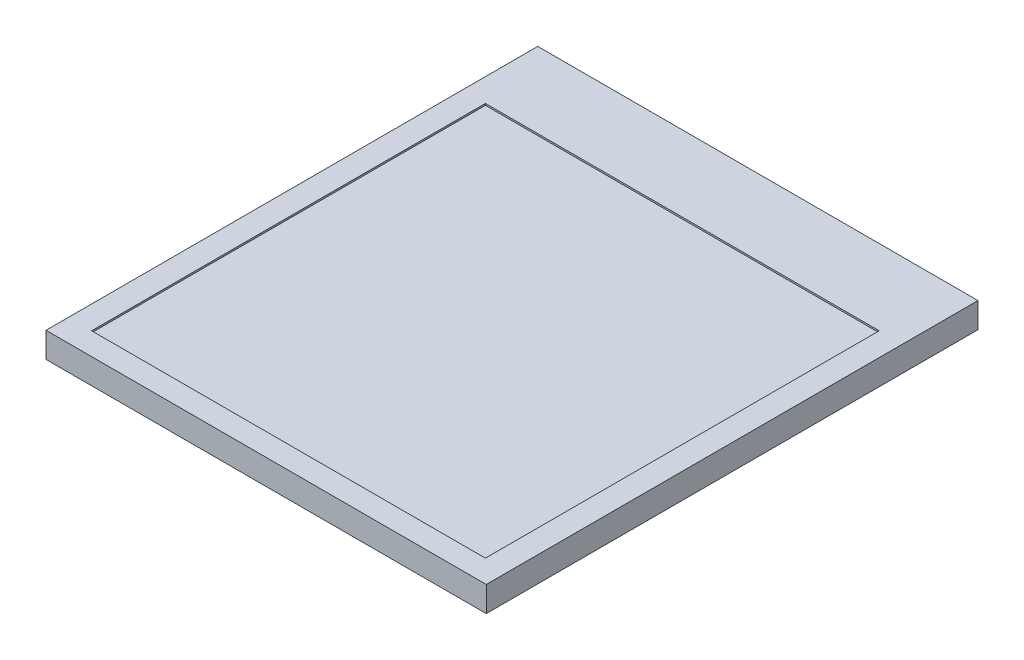
from build123d import *

# Parameters (mm, degrees)
SKETCH_1_W          = 26.16
SKETCH_1_H          = 29.22
EXTRUDE_1_DEPTH     = 1.5
EXTRUDE_2_DEPTH     = 15.86
SKETCH_4_W          = 4.46
SKETCH_4_H          = 3
CUT_EXTRUDE_1_DEPTH = 1
FILLET_2_R          = 1
SKETCH_5_W          = 23.4
SKETCH_5_H          = 23.4
CUT_EXTRUDE_2_DEPTH = 0.1
SKETCH_6_W          = 0.35
SKETCH_6_H          = 3
CUT_EXTRUDE_3_DEPTH = 0.005


with BuildPart() as part:
    # 草图1 → 凸台-拉伸1 (new body)
    with BuildSketch(Plane(origin=(0, 0, 0), x_dir=(1, 0, 0), z_dir=(0, 1, 0))):
        Rectangle(SKETCH_1_W, SKETCH_1_H)
    extrude(amount=EXTRUDE_1_DEPTH)

    # 草图3 → 凸台-拉伸2 (add)
    with BuildSketch(Plane.ZY.offset(13.08)):
        with BuildLine():
            Line((-14.61, 0), (-14.864156079, 0))
            ThreePointArc((-14.864156079, 0), (-15.664156079, -0.8), (-14.864156079, -1.6))
            Line((-14.864156079, -1.6), (-3.11, -1.6))
            Line((-3.11, -1.6), (-3.11, -1.8))
            Line((-3.11, -1.8), (-14.864156079, -1.8))
            ThreePointArc((-14.864156079, -1.8), (-15.864156079, -0.8), (-14.864156079, 0.2))
            Line((-14.864156079, 0.2), (-14.61, 0.2))
            Line((-14.61, 0.2), (-14.61, 0))
        make_face()
    extrude(amount=-EXTRUDE_2_DEPTH)

    # 草图4 → 切除-拉伸1 (cut)
    with BuildSketch(Plane.XZ.offset(1.8)):
        with Locations((-10.85, -4.61)):
            Rectangle(SKETCH_4_W, SKETCH_4_H)
    extrude(amount=-CUT_EXTRUDE_1_DEPTH, mode=Mode.SUBTRACT)

    # 圆角2
    fillet_2_edges = [part.edges().sort_by_distance(p)[0] for p in [
        (2.78, -1.7, -3.11),
        (-13.08, -1.7, -6.11),
        (-8.62, -1.7, -3.11),
        (-8.62, -1.7, -6.11),
    ]]
    fillet(fillet_2_edges, radius=FILLET_2_R)

    # 草图5 → 切除-拉伸2 (cut)
    with BuildSketch(Plane(origin=(0, 1.5, 0), x_dir=(1, 0, 0), z_dir=(0, 1, 0))):
        with Locations((0, -1.58)):
            Rectangle(SKETCH_5_W, SKETCH_5_H)
    extrude(amount=-CUT_EXTRUDE_2_DEPTH, mode=Mode.SUBTRACT)

    # 草图6 → 切除-拉伸3 (cut)
    with BuildSketch(Plane.XZ.offset(1.8)):
        with Locations((-6.765, -4.61)):
            Rectangle(SKETCH_6_W, SKETCH_6_H)
        with Locations((-6.065, -4.61)):
            Rectangle(SKETCH_6_W, SKETCH_6_H)
        with Locations((-5.365, -4.61)):
            Rectangle(SKETCH_6_W, SKETCH_6_H)
        with Locations((-4.665, -4.61)):
            Rectangle(SKETCH_6_W, SKETCH_6_H)
        with Locations((-3.965, -4.61)):
            Rectangle(SKETCH_6_W, SKETCH_6_H)
        with Locations((-3.265, -4.61)):
            Rectangle(SKETCH_6_W, SKETCH_6_H)
        with Locations((-2.565, -4.61)):
            Rectangle(SKETCH_6_W, SKETCH_6_H)
        with Locations((-1.865, -4.61)):
            Rectangle(SKETCH_6_W, SKETCH_6_H)
        with Locations((-1.165, -4.61)):
            Rectangle(SKETCH_6_W, SKETCH_6_H)
        with Locations((-0.465, -4.61)):
            Rectangle(SKETCH_6_W, SKETCH_6_H)
        with Locations((0.235, -4.61)):
            Rectangle(SKETCH_6_W, SKETCH_6_H)
        with Locations((0.935, -4.61)):
            Rectangle(SKETCH_6_W, SKETCH_6_H)
    extrude(amount=-CUT_EXTRUDE_3_DEPTH, mode=Mode.SUBTRACT)


solid = part.part
